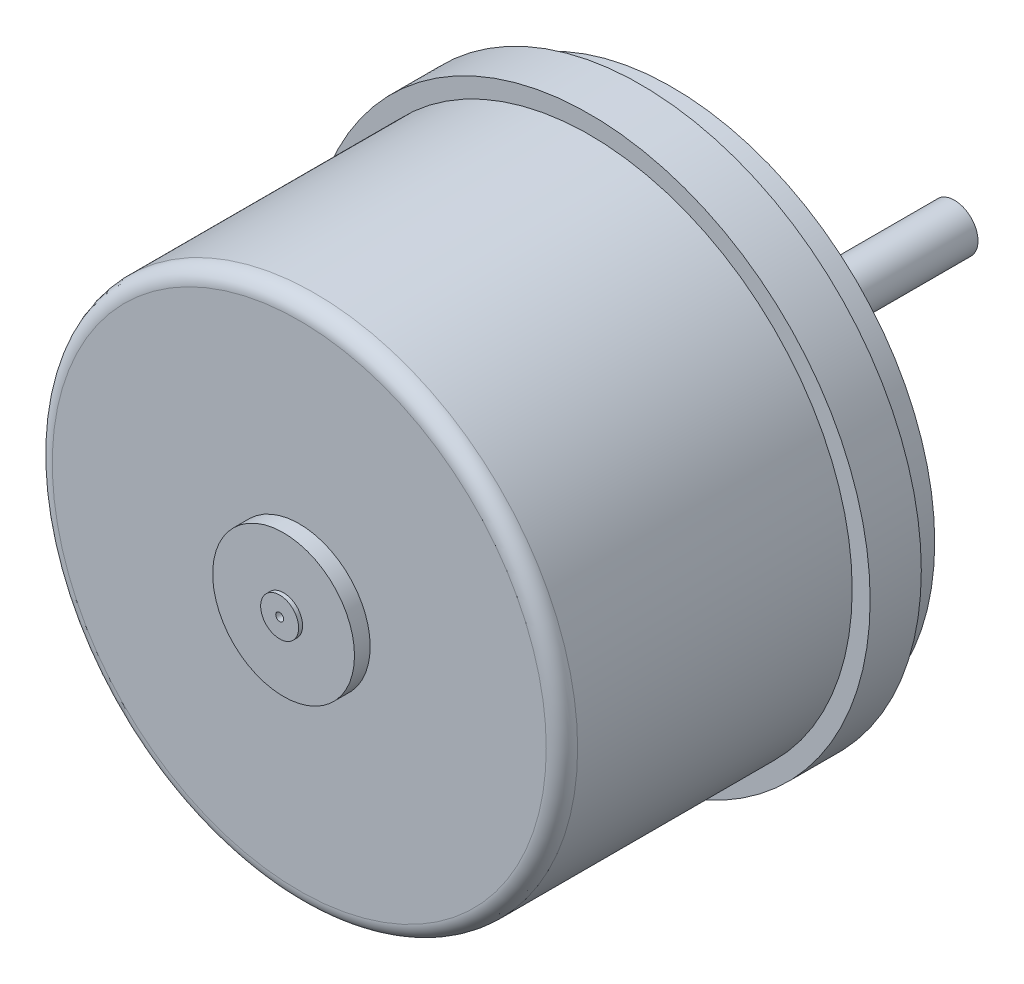
from build123d import *

# Parameters (mm, degrees)
CROQUIS1_R              = 33.485
SALIENTE_EXTRUIR1_DEPTH = 2
CROQUIS2_R              = 35.775
SALIENTE_EXTRUIR2_DEPTH = 6.52
SALIENTE_EXTRUIR3_START = 37
CROQUIS3_R              = 33.485
SALIENTE_EXTRUIR3_DEPTH = 37
CROQUIS4_R              = 9.04
SALIENTE_EXTRUIR4_DEPTH = 2
CROQUIS5_R              = 2.425
SALIENTE_EXTRUIR5_DEPTH = 0.5
CROQUIS6_R              = 0.5
CORTAR_EXTRUIR1_DEPTH   = 1
CROQUIS7_R              = 3
SALIENTE_EXTRUIR6_DEPTH = 36
REDONDEO2_R             = 2


with BuildPart() as part:
    # Croquis1 → Saliente-Extruir1 (new, symmetric)
    with BuildSketch(Plane.XY):
        Circle(CROQUIS1_R)
    extrude(amount=SALIENTE_EXTRUIR1_DEPTH, both=True)

    # Croquis2 → Saliente-Extruir2 (add)
    with BuildSketch(Plane.XY.offset(2)):
        Circle(CROQUIS2_R)
    extrude(amount=SALIENTE_EXTRUIR2_DEPTH)

    # Croquis3 → Saliente-Extruir3 (add)
    with BuildSketch(Plane.XY.offset(8.52).offset(SALIENTE_EXTRUIR3_START)):
        Circle(CROQUIS3_R)
    extrude(amount=-SALIENTE_EXTRUIR3_DEPTH)

    # Croquis4 → Saliente-Extruir4 (add)
    with BuildSketch(Plane.XY.offset(45.52)):
        Circle(CROQUIS4_R)
    extrude(amount=SALIENTE_EXTRUIR4_DEPTH)

    # Croquis5 → Saliente-Extruir5 (add)
    with BuildSketch(Plane.XY.offset(47.52)):
        Circle(CROQUIS5_R)
    extrude(amount=SALIENTE_EXTRUIR5_DEPTH)

    # Croquis6 → Cortar-Extruir1 (cut)
    with BuildSketch(Plane.XY.offset(48.02)):
        Circle(CROQUIS6_R)
    extrude(amount=-CORTAR_EXTRUIR1_DEPTH, mode=Mode.SUBTRACT)

    # Croquis7 → Saliente-Extruir6 (add)
    with BuildSketch(Plane(origin=(0, 0, -2), x_dir=(-1, 0, 0), z_dir=(0, 0, -1))):
        with Locations(Location((0, 0, 0), (0, 0, 180))):
            Circle(CROQUIS7_R)
    extrude(amount=SALIENTE_EXTRUIR6_DEPTH)

    # Redondeo2
    redondeo2_edges = [part.edges().sort_by_distance(p)[0] for p in [
        (-33.485, 0, 45.52),
    ]]
    fillet(redondeo2_edges, radius=REDONDEO2_R)


solid = part.part
